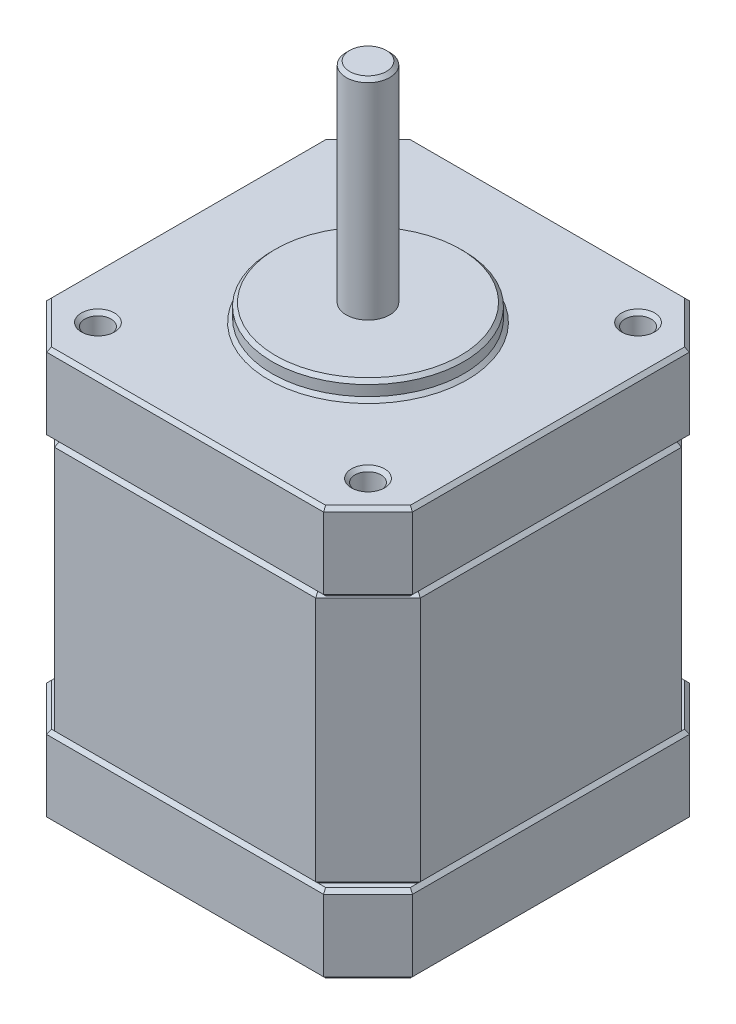
from build123d import *

# Parameters (mm, degrees)
SKETCH1_W           = 42
SKETCH1_H           = 42
BOSS_EXTRUDE1_DEPTH = 9
CHAMFER1_SIZE       = 5.1
CHAMFER2_SIZE       = 0.4
SKETCH3_W           = 42
SKETCH3_H           = 42
BOSS_EXTRUDE3_DEPTH = 29
CHAMFER3_SIZE       = 6
CHAMFER4_SIZE       = 0.4
SKETCH4_W           = 42
SKETCH4_H           = 42
BOSS_EXTRUDE4_DEPTH = 9
CHAMFER5_SIZE       = 5.1
SKETCH5_R           = 11
BOSS_EXTRUDE5_DEPTH = 2
SKETCH7_R           = 1.5
CUT_EXTRUDE1_DEPTH  = 5
CHAMFER6_SIZE       = 0.4
SKETCH6_R           = 2.5
BOSS_EXTRUDE6_DEPTH = 24
CHAMFER7_SIZE       = 0.4


with BuildPart() as part:
    # Sketch1 → Boss-Extrude1 (new body)
    with BuildSketch(Plane(origin=(0, 0, 0), x_dir=(1, 0, 0), z_dir=(0, 1, 0))):
        Rectangle(SKETCH1_W, SKETCH1_H)
    extrude(amount=BOSS_EXTRUDE1_DEPTH)

    # Chamfer1
    chamfer1_edges = [part.edges().sort_by_distance(p)[0] for p in [
        (21, 4.5, 21),
        (-21, 4.5, 21),
        (-21, 4.5, -21),
        (21, 4.5, -21),
    ]]
    chamfer(chamfer1_edges, length=CHAMFER1_SIZE)

    # Chamfer2
    chamfer2_edges = [part.edges().sort_by_distance(p)[0] for p in [
        (-21, 0, 0),
        (-21, 9, 0),
        (21, 0, 0),
        (0, 0, 21),
        (0, 0, -21),
        (-18.45, 0, 18.45),
        (18.45, 0, 18.45),
        (18.45, 0, -18.45),
        (-18.45, 0, -18.45),
        (0, 9, -21),
        (21, 9, 0),
        (0, 9, 21),
        (-18.45, 9, 18.45),
        (18.45, 9, 18.45),
        (18.45, 9, -18.45),
        (-18.45, 9, -18.45),
    ]]
    chamfer(chamfer2_edges, length=CHAMFER2_SIZE)


with BuildPart() as body_2:
    # Sketch3 → Boss-Extrude3 (new body)
    with BuildSketch(Plane(origin=(0, 9, 0), x_dir=(1, 0, 0), z_dir=(0, 1, 0))):
        Rectangle(SKETCH3_W, SKETCH3_H)
    extrude(amount=BOSS_EXTRUDE3_DEPTH)

    # Chamfer3
    chamfer3_edges = [body_2.edges().sort_by_distance(p)[0] for p in [
        (-21, 23.5, -21),
        (21, 23.5, -21),
        (21, 23.5, 21),
        (-21, 23.5, 21),
    ]]
    chamfer(chamfer3_edges, length=CHAMFER3_SIZE)

    # Chamfer4
    chamfer4_edges = [body_2.edges().sort_by_distance(p)[0] for p in [
        (-21, 9, 0),
        (-21, 38, 0),
        (0, 9, -21),
        (21, 9, 0),
        (0, 9, 21),
        (18, 9, 18),
        (-18, 9, 18),
        (18, 9, -18),
        (-18, 9, -18),
        (0, 38, -21),
        (0, 38, 21),
        (21, 38, 0),
        (18, 38, 18),
        (-18, 38, 18),
        (18, 38, -18),
        (-18, 38, -18),
    ]]
    chamfer(chamfer4_edges, length=CHAMFER4_SIZE)


with BuildPart() as body_3:
    # Sketch4 → Boss-Extrude4 (new body)
    with BuildSketch(Plane(origin=(0, 38, 0), x_dir=(1, 0, 0), z_dir=(0, 1, 0))):
        Rectangle(SKETCH4_W, SKETCH4_H)
    extrude(amount=BOSS_EXTRUDE4_DEPTH)

    # Chamfer5
    chamfer5_edges = [body_3.edges().sort_by_distance(p)[0] for p in [
        (-21, 42.5, -21),
        (21, 42.5, -21),
        (21, 42.5, 21),
        (-21, 42.5, 21),
    ]]
    chamfer(chamfer5_edges, length=CHAMFER5_SIZE)

    # Sketch5 → Boss-Extrude5 (add)
    with BuildSketch(Plane(origin=(0, 47, 0), x_dir=(1, 0, 0), z_dir=(0, 1, 0))):
        with Locations(Location((0, 0, 0), (0, 0, 270))):
            Circle(SKETCH5_R)
    extrude(amount=BOSS_EXTRUDE5_DEPTH)

    # Sketch7 → Cut-Extrude1 (cut)
    with BuildSketch(Plane(origin=(0, 47, 0), x_dir=(1, 0, 0), z_dir=(0, 1, 0))):
        with Locations(Location((15.5, -15.5, 0), (0, 0, 270))):
            Circle(SKETCH7_R)
        with Locations(Location((-15.5, -15.5, 0), (0, 0, 270))):
            Circle(SKETCH7_R)
        with Locations(Location((15.5, 15.5, 0), (0, 0, 270))):
            Circle(SKETCH7_R)
        with Locations(Location((-15.5, 15.5, 0), (0, 0, 270))):
            Circle(SKETCH7_R)
    extrude(amount=-CUT_EXTRUDE1_DEPTH, mode=Mode.SUBTRACT)

    # Chamfer6
    chamfer6_edges = [body_3.edges().sort_by_distance(p)[0] for p in [
        (21, 38, 0),
        (21, 47, 0),
        (-21, 38, 0),
        (0, 38, -21),
        (0, 38, 21),
        (18.45, 38, -18.45),
        (-18.45, 38, -18.45),
        (-18.45, 38, 18.45),
        (18.45, 38, 18.45),
        (0, 47, 21),
        (-21, 47, 0),
        (0, 47, -21),
        (18.45, 47, -18.45),
        (-18.45, 47, -18.45),
        (-18.45, 47, 18.45),
        (18.45, 47, 18.45),
        (0, 47, -11),
        (0, 49, -11),
        (-15.5, 42, 14),
        (-15.5, 47, 14),
        (15.5, 42, -17),
        (15.5, 47, -17),
        (-15.5, 42, -17),
        (-15.5, 47, -17),
        (15.5, 42, 14),
        (15.5, 47, 14),
    ]]
    chamfer(chamfer6_edges, length=CHAMFER6_SIZE)


with BuildPart() as body_4:
    # Sketch6 → Boss-Extrude6 (new body)
    with BuildSketch(Plane(origin=(0, 49, 0), x_dir=(1, 0, 0), z_dir=(0, 1, 0))):
        with Locations(Location((0, 0, 0), (0, 0, 270))):
            Circle(SKETCH6_R)
    extrude(amount=BOSS_EXTRUDE6_DEPTH)

    # Chamfer7
    chamfer7_edges = [body_4.edges().sort_by_distance(p)[0] for p in [
        (0, 73, -2.5),
    ]]
    chamfer(chamfer7_edges, length=CHAMFER7_SIZE)


solid = Compound([part.part, body_2.part, body_3.part, body_4.part])
